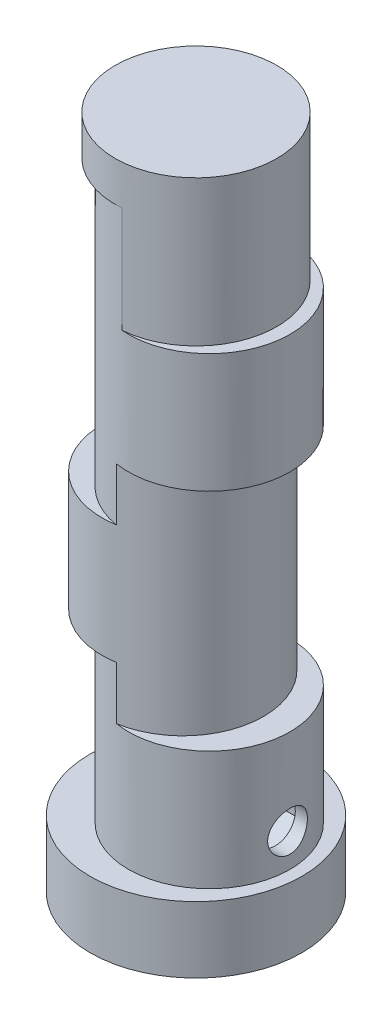
from build123d import *

# Parameters (mm, degrees)
SKETCH1_R           = 8
BOSS_EXTRUDE1_DEPTH = 5
SKETCH2_R           = 6.1
BOSS_EXTRUDE2_DEPTH = 9
SKETCH3_R           = 6.1
BOSS_EXTRUDE3_DEPTH = 17
SKETCH4_R           = 6.1
BOSS_EXTRUDE4_DEPTH = 9
CUT_EXTRUDE1_START  = -4
CUT_EXTRUDE1_DEPTH  = 4
CUT_EXTRUDE2_DEPTH  = 4
SKETCH7_R           = 6.1
BOSS_EXTRUDE5_DEPTH = 11
CUT_EXTRUDE3_DEPTH  = 8
SKETCH9_R           = 3.15
CUT_EXTRUDE4_DEPTH  = 25
SKETCH10_R          = 1.5
CUT_EXTRUDE5_DEPTH  = 53.239831546
SKETCH11_R          = 1.5
CUT_EXTRUDE6_DEPTH  = 6


with BuildPart() as part:
    # Sketch1 → Boss-Extrude1 (new body)
    with BuildSketch(Plane(origin=(0, 0, 0), x_dir=(1, 0, 0), z_dir=(0, 1, 0))):
        with Locations(Location((0, 0, 0), (0, 0, 270))):
            Circle(SKETCH1_R)
    extrude(amount=BOSS_EXTRUDE1_DEPTH)

    # Sketch2 → Boss-Extrude2 (add)
    with BuildSketch(Plane(origin=(0, 5, 0), x_dir=(1, 0, 0), z_dir=(0, 1, 0))):
        with Locations(Location((1, 0, 0), (0, 0, 270))):
            Circle(SKETCH2_R)
    extrude(amount=BOSS_EXTRUDE2_DEPTH)

    # Sketch3 → Boss-Extrude3 (add)
    with BuildSketch(Plane(origin=(0, 14, 0), x_dir=(1, 0, 0), z_dir=(0, 1, 0))):
        with Locations(Location((-1, 0, 0), (0, 0, 80.564661277))):
            Circle(SKETCH3_R)
    extrude(amount=BOSS_EXTRUDE3_DEPTH)

    # Sketch4 → Boss-Extrude4 (add)
    with BuildSketch(Plane(origin=(0, 31, 0), x_dir=(1, 0, 0), z_dir=(0, 1, 0))):
        with Locations(Location((1, 0, 0), (0, 0, 99.435338723))):
            Circle(SKETCH4_R)
    extrude(amount=BOSS_EXTRUDE4_DEPTH)

    # Sketch5 → Cut-Extrude1 (cut)
    with BuildSketch(Plane(origin=(0, 31, 0), x_dir=(1, 0, 0), z_dir=(0, 1, 0)).offset(CUT_EXTRUDE1_START)):
        with BuildLine():
            ThreePointArc((0, 6.017474553), (-5.1, 0), (0, -6.017474553))
            ThreePointArc((0, -6.017474553), (-7.1, 0), (0, 6.017474553))
        make_face()
    extrude(amount=CUT_EXTRUDE1_DEPTH, mode=Mode.SUBTRACT)

    # Sketch6 → Cut-Extrude2 (cut)
    with BuildSketch(Plane.XZ.offset(-14)):
        with BuildLine():
            ThreePointArc((0, 6.017474553), (-7.1, 0), (0, -6.017474553))
            ThreePointArc((0, -6.017474553), (-5.1, 0), (0, 6.017474553))
        make_face()
    extrude(amount=-CUT_EXTRUDE2_DEPTH, mode=Mode.SUBTRACT)

    # Sketch7 → Boss-Extrude5 (add)
    with BuildSketch(Plane(origin=(0, 40, 0), x_dir=(1, 0, 0), z_dir=(0, 1, 0))):
        with Locations(Location((0, 0, 0), (0, 0, 85.298349803))):
            Circle(SKETCH7_R)
    extrude(amount=BOSS_EXTRUDE5_DEPTH)

    # Sketch8 → Cut-Extrude3 (cut)
    with BuildSketch(Plane.XZ.offset(-40)):
        with BuildLine():
            ThreePointArc((0.5, 6.079473661), (-6.1, 0), (0.5, -6.079473661))
            ThreePointArc((0.5, -6.079473661), (-5.1, 0), (0.5, 6.079473661))
        make_face()
    extrude(amount=-CUT_EXTRUDE3_DEPTH, mode=Mode.SUBTRACT)

    # Sketch9 → Cut-Extrude4 (cut)
    with BuildSketch(Plane.XZ):
        with Locations(Location((0, 0, 0), (0, 0, 270))):
            Circle(SKETCH9_R)
    extrude(amount=-CUT_EXTRUDE4_DEPTH, mode=Mode.SUBTRACT)

    # Sketch10 → Cut-Extrude5 (cut, through all)
    with BuildSketch(Plane(origin=(0, 0, 0), x_dir=(0, 0, -1), z_dir=(1, 0, 0))):
        with Locations(Location((0, 7.5, 0), (0, 0, 180))):
            Circle(SKETCH10_R)
    extrude(amount=CUT_EXTRUDE5_DEPTH, mode=Mode.SUBTRACT)

    # Sketch11 → Cut-Extrude6 (cut)
    with BuildSketch(Plane(origin=(0, 0, 0), x_dir=(0, 0, -1), z_dir=(1, 0, 0))):
        Polygon((0, 10.733161507), (-2.8, 9.116580754), (-2.8, 5.883419246), (0, 4.266838493), (2.8, 5.883419246), (2.8, 9.116580754), align=None)
        with Locations(Location((0, 7.5, 0), (0, 0, 180))):
            Circle(SKETCH11_R, mode=Mode.SUBTRACT)
    extrude(amount=CUT_EXTRUDE6_DEPTH, mode=Mode.SUBTRACT)


solid = part.part
